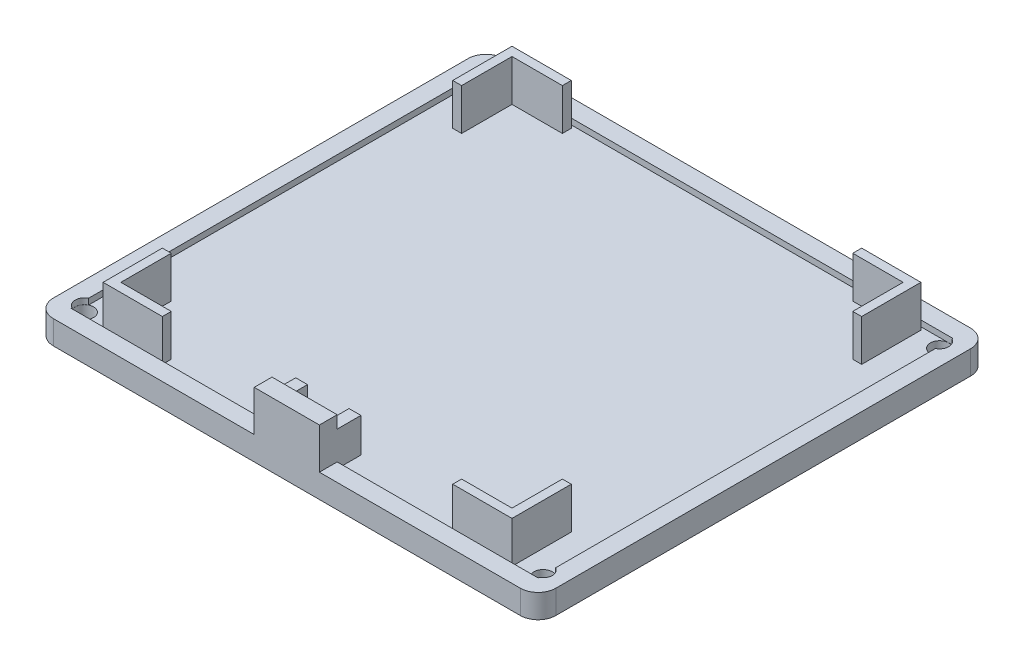
from build123d import *

# Parameters (mm, degrees)
SKETCH2_W           = 84.8
SKETCH2_H           = 76
SKETCH2_R           = 1.55
BOSS_EXTRUDE1_DEPTH = 3
SKETCH3_W           = 11
SKETCH3_H           = 3
BOSS_EXTRUDE2_DEPTH = 7.9
FILLET1_R           = 3
BOSS_EXTRUDE3_START = 1
BOSS_EXTRUDE3_DEPTH = 1
BOSS_EXTRUDE5_DEPTH = 7
SKETCH10_R          = 2.55
CUT_EXTRUDE2_DEPTH  = 1
CUT_EXTRUDE3_DEPTH  = 1
SKETCH13_W          = 2
SKETCH13_H          = 4
BOSS_EXTRUDE6_DEPTH = 5.8


with BuildPart() as part:
    # Sketch2 → Boss-Extrude1 (new body)
    with BuildSketch(Plane(origin=(0, 0, 0), x_dir=(1, 0, 0), z_dir=(0, 1, 0))):
        Rectangle(SKETCH2_W, SKETCH2_H)
        with Locations(Location((38.7, 33.44, 0), (0, 0, 270))):
            Circle(SKETCH2_R, mode=Mode.SUBTRACT)
        with Locations(Location((38.7, -33.44, 0), (0, 0, 270))):
            Circle(SKETCH2_R, mode=Mode.SUBTRACT)
        with Locations(Location((-38.7, 33.44, 0), (0, 0, 270))):
            Circle(SKETCH2_R, mode=Mode.SUBTRACT)
        with Locations(Location((-38.7, -33.44, 0), (0, 0, 270))):
            Circle(SKETCH2_R, mode=Mode.SUBTRACT)
    extrude(amount=BOSS_EXTRUDE1_DEPTH)

    # Sketch3 → Boss-Extrude2 (add)
    with BuildSketch(Plane(origin=(0, 3, 0), x_dir=(1, 0, 0), z_dir=(0, 1, 0))):
        with Locations((0, -36.5)):
            Rectangle(SKETCH3_W, SKETCH3_H)
    extrude(amount=BOSS_EXTRUDE2_DEPTH)

    # Fillet1
    fillet1_edges = [part.edges().sort_by_distance(p)[0] for p in [
        (42.4, 1.5, 38),
        (-42.4, 1.5, 38),
        (-42.4, 1.5, -38),
        (42.4, 1.5, -38),
    ]]
    fillet(fillet1_edges, radius=FILLET1_R)

    # Sketch4 → Boss-Extrude3 (add)
    with BuildSketch(Plane(origin=(0, 3, 0), x_dir=(1, 0, 0), z_dir=(0, 1, 0)).offset(BOSS_EXTRUDE3_START)):
        with BuildLine():
            Line((5.5, -38), (39.4, -38))
            ThreePointArc((39.4, -38), (41.521320344, -37.121320344), (42.4, -35))
            Line((42.4, -35), (42.4, 35))
            ThreePointArc((42.4, 35), (41.521320344, 37.121320344), (39.4, 38))
            Line((39.4, 38), (-39.4, 38))
            ThreePointArc((-39.4, 38), (-41.521320344, 37.121320344), (-42.4, 35))
            Line((-42.4, 35), (-42.4, -35))
            ThreePointArc((-42.4, -35), (-41.521320344, -37.121320344), (-39.4, -38))
            Line((-39.4, -38), (-5.5, -38))
            Line((-5.5, -38), (5.5, -38))
        make_face()
        with BuildLine():
            Line((39.4, -35), (39.4, -34.834130553))
            ThreePointArc((39.4, -34.834130553), (40.26, -33.44), (39.4, -32.045869447))
            Line((39.4, -32.045869447), (39.4, 32.045869447))
            ThreePointArc((39.4, 32.045869447), (40.26, 33.44), (39.4, 34.834130553))
            Line((39.4, 34.834130553), (39.4, 35))
            Line((39.4, 35), (-39.4, 35))
            Line((-39.4, 35), (-39.4, 34.834130553))
            ThreePointArc((-39.4, 34.834130553), (-40.26, 33.44), (-39.4, 32.045869447))
            Line((-39.4, 32.045869447), (-39.4, -32.045869447))
            ThreePointArc((-39.4, -32.045869447), (-40.26, -33.44), (-39.4, -34.834130553))
            Line((-39.4, -34.834130553), (-39.4, -35))
            Line((-39.4, -35), (-5.5, -35))
            Line((-5.5, -35), (5.5, -35))
            Line((5.5, -35), (39.4, -35))
        make_face(mode=Mode.SUBTRACT)
    extrude(amount=-BOSS_EXTRUDE3_DEPTH)

    # Sketch9 → Boss-Extrude5 (add)
    with BuildSketch(Plane(origin=(0, 3, 0), x_dir=(1, 0, 0), z_dir=(0, 1, 0))):
        Polygon((-34.5, 34.5), (-24.5, 34.5), (-24.5, 33), (-33, 33), (-33, 24.5), (-34.5, 24.5), align=None)
        Polygon((34.5, 34.5), (24.5, 34.5), (24.5, 33), (33, 33), (33, 24.5), (34.5, 24.5), align=None)
        Polygon((34.5, -34.5), (34.5, -24.5), (33, -24.5), (33, -33), (24.5, -33), (24.5, -34.5), align=None)
        Polygon((-34.5, -34.5), (-34.5, -24.5), (-33, -24.5), (-33, -33), (-24.5, -33), (-24.5, -34.5), align=None)
    extrude(amount=BOSS_EXTRUDE5_DEPTH)

    # Sketch10 → Cut-Extrude2 (cut)
    with BuildSketch(Plane.XZ):
        with Locations(Location((-38.7, 33.44, 0), (0, 0, 270))):
            Circle(SKETCH10_R)
        with Locations(Location((38.7, 33.44, 0), (0, 0, 270))):
            Circle(SKETCH10_R)
        with Locations(Location((38.7, -33.44, 0), (0, 0, 270))):
            Circle(SKETCH10_R)
        with Locations(Location((-38.7, -33.44, 0), (0, 0, 270))):
            Circle(SKETCH10_R)
    extrude(amount=-CUT_EXTRUDE2_DEPTH, mode=Mode.SUBTRACT)

    # Sketch11 → Cut-Extrude3 (cut)
    # profile 1 of 3: a face of its own
    with BuildSketch(Plane.XZ):
        with BuildLine():
            Line((2.339643561, -30.971841996), (1.428866317, -30.338368438))
            Line((1.428866317, -30.338368438), (4.960036189, -25.176449368))
            add(Edge.make_bspline(
                [(4.960036189, -25.176449368), (4.73473552, -25.20400134), (4.291105941, -25.258252711), (3.844294171, -25.268219143), (3.62439917, -25.273124047)],
                knots=[0, 0, 0, 0, 1.015715272, 2, 2, 2, 2], degree=3))
            add(Edge.make_bspline(
                [(3.62439917, -25.273124047), (3.491078025, -25.269709284), (3.229380276, -25.263006403), (2.844636851, -25.209877555), (2.474937817, -25.128052806), (2.121263297, -25.005955895), (1.782283951, -24.854215536), (1.458739791, -24.666048658), (1.15106636, -24.444682972), (0.862568043, -24.191288974), (0.600179734, -23.913057183), (0.366415196, -23.618578136), (0.172137374, -23.304431043), (0.010750907, -22.977024246), (-0.111642453, -22.631651916), (-0.200769375, -22.272244092), (-0.255641918, -21.896281849), (-0.262170064, -21.640376374), (-0.265484644, -21.510443759)],
                knots=[0, 0, 0, 0, 1.060718605, 2.082097864, 3.085795603, 4.069760067, 5.054557537, 6.03741023, 7.043284206, 8.066802108, 9.088538119, 10.083643548, 11.053783639, 12.022749082, 12.983451788, 13.964007469, 14.966251758, 16, 16, 16, 16], degree=3))
            add(Edge.make_bspline(
                [(-0.265484644, -21.510443759), (-0.259191124, -21.332757505), (-0.24683822, -20.983995433), (-0.147420743, -20.474421471), (0.016083916, -19.992596013), (0.244061169, -19.539785881), (0.531207158, -19.122504741), (0.876315471, -18.746553502), (1.277286999, -18.417279318), (1.724987468, -18.134235952), (2.208868429, -17.906597533), (2.715666132, -17.738814928), (3.241497367, -17.640122329), (3.59770577, -17.627110776), (3.7770434, -17.620559945)],
                knots=[0, 0, 0, 0, 1.022988612, 2.007919123, 2.978103895, 3.94594894, 4.918897164, 5.887013414, 6.875921846, 7.89917871, 8.930658928, 9.948724884, 10.967259574, 12, 12, 12, 12], degree=3))
            add(Edge.make_bspline(
                [(3.7770434, -17.620559945), (3.952987094, -17.627200822), (4.30063525, -17.64032257), (4.811861074, -17.736421543), (5.301504192, -17.898388899), (5.766850287, -18.122215744), (6.197704726, -18.402780181), (6.585148384, -18.737096881), (6.920339625, -19.12537408), (7.202729135, -19.558220887), (7.429406139, -20.023283933), (7.592954137, -20.508728452), (7.69363117, -21.01106324), (7.706317843, -21.351403189), (7.712720484, -21.523164111)],
                knots=[0, 0, 0, 0, 1.026385292, 2.028040595, 3.023318987, 4.028184125, 5.03290303, 6.015178782, 7.004435299, 8.016004309, 9.023023918, 10.015172535, 10.998308025, 12, 12, 12, 12], degree=3))
            add(Edge.make_bspline(
                [(7.712720484, -21.523164111), (7.708444543, -21.656491495), (7.699771866, -21.926912743), (7.63904298, -22.337777129), (7.535918308, -22.756700162), (7.418890716, -23.111289952), (7.305925422, -23.404146327), (7.199604172, -23.635473489), (7.081631501, -23.878955216), (6.944040552, -24.132038413), (6.796131647, -24.397949326), (6.629002272, -24.674020895), (6.446464911, -24.960623584), (6.316454214, -25.153834446), (6.249879939, -25.252771483)],
                knots=[0, 0, 0, 0, 1.179839688, 2.393009684, 3.667231171, 4.993948276, 5.694988576, 6.444077775, 7.246288328, 8.089075292, 8.993003841, 9.939041771, 10.944649915, 12, 12, 12, 12], degree=3))
            Line((6.249879939, -25.252771483), (2.339643561, -30.971841996))
        make_face()
        with BuildLine():
            add(Edge.make_bspline(
                [(3.835557022, -23.970559945), (3.936554731, -23.967800838), (4.133162934, -23.962429795), (4.421189133, -23.929739117), (4.693056957, -23.871776368), (4.949492633, -23.788610555), (5.193067391, -23.688256357), (5.419912354, -23.56048715), (5.63021737, -23.408026789), (5.825390705, -23.236721875), (5.99870579, -23.046401186), (6.153076215, -22.847203113), (6.284287417, -22.638253243), (6.387931308, -22.416934834), (6.473146768, -22.188635249), (6.531994983, -21.949678017), (6.564595278, -21.701308106), (6.570152707, -21.532584404), (6.572976894, -21.446841996)],
                knots=[0, 0, 0, 0, 1.163407946, 2.26475976, 3.333800367, 4.359385343, 5.366239384, 6.363380779, 7.350133999, 8.353570782, 9.349036268, 10.310270964, 11.253520213, 12.184142, 13.120487599, 14.056272588, 15.012232024, 16, 16, 16, 16], degree=3))
            add(Edge.make_bspline(
                [(6.572976894, -21.446841996), (6.570546952, -21.361063782), (6.565758452, -21.19202729), (6.527341679, -20.943289663), (6.459758726, -20.704916973), (6.369078968, -20.475604213), (6.249625533, -20.257235435), (6.106284313, -20.047069043), (5.935986567, -19.846437608), (5.740034398, -19.660059725), (5.528726163, -19.488254491), (5.303535205, -19.336630729), (5.066317653, -19.209553817), (4.818520732, -19.10469184), (4.559628152, -19.022861112), (4.289793109, -18.964015245), (4.007652066, -18.931460593), (3.816131399, -18.92593829), (3.718529779, -18.923124047)],
                knots=[0, 0, 0, 0, 0.972161553, 1.915763587, 2.844109794, 3.775983486, 4.705125789, 5.659731448, 6.655561913, 7.682237399, 8.721216875, 9.739758359, 10.754845918, 11.767244016, 12.7857855, 13.828538656, 14.893392813, 16, 16, 16, 16], degree=3))
            add(Edge.make_bspline(
                [(3.718529779, -18.923124047), (3.621776994, -18.925942836), (3.431948826, -18.931473278), (3.152316019, -18.963953365), (2.884305496, -19.023256865), (2.626163045, -19.104653936), (2.378373488, -19.209561639), (2.141167124, -19.336637388), (1.915923491, -19.488219589), (1.704817847, -19.660194906), (1.508519673, -19.845570079), (1.341149896, -20.04794795), (1.197480631, -20.25712611), (1.078191335, -20.475633268), (0.987467915, -20.704909219), (0.919896652, -20.943291763), (0.881476738, -21.192026743), (0.876688669, -21.361063598), (0.874258945, -21.446841996)],
                knots=[0, 0, 0, 0, 1.099389452, 2.15699305, 3.192601482, 4.213358962, 5.227959689, 6.245255729, 7.266013209, 8.307253147, 9.336162325, 10.327954924, 11.284637477, 12.215801273, 13.149702402, 14.080068371, 15.025723358, 16, 16, 16, 16], degree=3))
            add(Edge.make_bspline(
                [(0.874258945, -21.446841996), (0.876457592, -21.532651174), (0.880793724, -21.701882579), (0.922623133, -21.950535491), (0.992575748, -22.188889794), (1.086263251, -22.419263103), (1.20964045, -22.639415274), (1.361038412, -22.848302558), (1.538495679, -23.048292906), (1.739640049, -23.236279075), (1.959778804, -23.40882554), (2.194898426, -23.559521498), (2.440951262, -23.686784368), (2.698803466, -23.788897389), (2.966544139, -23.870945425), (3.246579616, -23.92963229), (3.537983792, -23.962116229), (3.735414298, -23.96771837), (3.835557022, -23.970559945)],
                knots=[0, 0, 0, 0, 0.952633368, 1.87876736, 2.791047057, 3.707742249, 4.635551637, 5.587206343, 6.568248508, 7.601284464, 8.641511608, 9.671105535, 10.699146789, 11.713763218, 12.747829548, 13.806491675, 14.887386225, 16, 16, 16, 16], degree=3))
        make_face(mode=Mode.SUBTRACT)
    # profile 2 of 3: a face of its own
    with BuildSketch(Plane.XZ):
        with BuildLine():
            add(Edge.make_bspline(
                [(9.340925612, -24.301289111), (9.342115849, -24.097735733), (9.344427902, -23.702330362), (9.370148744, -23.126168946), (9.412876415, -22.585655897), (9.471432025, -22.080765344), (9.542689839, -21.611366941), (9.637814605, -21.178715108), (9.745992488, -20.780807392), (9.871368506, -20.416346245), (10.012838483, -20.080421437), (10.166814229, -19.766821421), (10.339406483, -19.476020695), (10.520751282, -19.203377855), (10.71818937, -18.953355877), (10.926102124, -18.72242393), (11.152604361, -18.515919207), (11.389996419, -18.327791196), (11.64042759, -18.162874541), (11.89675955, -18.01761289), (12.160756649, -17.893516229), (12.433139655, -17.795942361), (12.711460365, -17.715348717), (12.996691722, -17.660234536), (13.289304671, -17.625556611), (13.48681302, -17.622241302), (13.586979298, -17.620559945)],
                knots=[0, 0, 0, 0, 1.646270934, 3.197905019, 4.663502075, 6.030701355, 7.308322542, 8.50163776, 9.611534131, 10.641858119, 11.616356847, 12.558055219, 13.465016945, 14.349605745, 15.204443733, 16.039544428, 16.859896111, 17.680448484, 18.487036065, 19.28249412, 20.06191084, 20.843045899, 21.620316918, 22.403196591, 23.190181807, 24, 24, 24, 24], degree=3))
            add(Edge.make_bspline(
                [(13.586979298, -17.620559945), (13.68798232, -17.622330017), (13.888845552, -17.625850134), (14.185809199, -17.659682725), (14.47591233, -17.7158208), (14.757918148, -17.795362622), (15.034143099, -17.894044078), (15.302426635, -18.017731617), (15.564435188, -18.161709221), (15.816005089, -18.33088729), (16.059898122, -18.519508693), (16.290123587, -18.732733234), (16.506702442, -18.968407929), (16.712352836, -19.224011264), (16.901240288, -19.504445715), (17.081121028, -19.80483377), (17.24212813, -20.130428622), (17.397193951, -20.475797749), (17.531041017, -20.850497311), (17.651749965, -21.252415156), (17.749282222, -21.686298634), (17.830523296, -22.149871295), (17.89346049, -22.644835592), (17.939298934, -23.170130508), (17.9635127, -23.72610164), (17.96807273, -24.106222978), (17.970412791, -24.301289111)],
                knots=[0, 0, 0, 0, 0.810914788, 1.612654377, 2.396697861, 3.181598691, 3.963628158, 4.749916497, 5.551656086, 6.361998678, 7.18212741, 8.025565596, 8.878627764, 9.750805457, 10.657531673, 11.591944965, 12.560506719, 13.57287815, 14.630710178, 15.753379473, 16.941251878, 18.199788006, 19.531962791, 20.947069417, 22.433333509, 24, 24, 24, 24], degree=3))
            add(Edge.make_bspline(
                [(17.970412791, -24.301289111), (17.96804847, -24.495504434), (17.963441687, -24.873925071), (17.93957038, -25.42739461), (17.892549061, -25.949901796), (17.833729961, -26.44269976), (17.752265038, -26.903737405), (17.65209772, -27.334610118), (17.540880835, -27.737178607), (17.403594582, -28.108144923), (17.253332861, -28.452684032), (17.089846864, -28.774419113), (16.914696352, -29.076193946), (16.723874334, -29.355593028), (16.520480521, -29.614595584), (16.300161687, -29.848629815), (16.069128421, -30.063334824), (15.824517655, -30.254385015), (15.569024312, -30.421607021), (15.307915662, -30.571154421), (15.036558813, -30.691741628), (14.761103242, -30.795283063), (14.477608885, -30.87438756), (14.186429125, -30.929084121), (13.889045068, -30.967444828), (13.688016532, -30.970371198), (13.586979298, -30.971841996)],
                knots=[0, 0, 0, 0, 1.561518951, 3.042555995, 4.452378317, 5.7783523, 7.031515105, 8.214008947, 9.334062868, 10.386615937, 11.391082383, 12.354592575, 13.286541444, 14.194233754, 15.072674879, 15.931287219, 16.775624067, 17.606195743, 18.42308326, 19.229000347, 20.022332153, 20.807536673, 21.593273796, 22.3848459, 23.188221202, 24, 24, 24, 24], degree=3))
            add(Edge.make_bspline(
                [(13.586979298, -30.971841996), (13.486815799, -30.970149792), (13.289312929, -30.966813096), (12.996659842, -30.932291841), (12.712606404, -30.876791015), (12.435750926, -30.799079338), (12.164672999, -30.703956932), (11.903066474, -30.580027851), (11.648022593, -30.437301372), (11.400221804, -30.274757986), (11.164320534, -30.088533593), (10.938991309, -29.882560317), (10.729894811, -29.651698224), (10.535279664, -29.399592618), (10.350316544, -29.128562853), (10.180175104, -28.834908471), (10.022800862, -28.519793855), (9.878951624, -28.181183151), (9.751412188, -27.81413527), (9.638753361, -27.414451108), (9.54980199, -26.978602942), (9.473663838, -26.510091353), (9.412252505, -26.006903092), (9.37032681, -25.468764982), (9.344414038, -24.896012367), (9.34210964, -24.503147757), (9.340925612, -24.301289111)],
                knots=[0, 0, 0, 0, 0.810891512, 1.598919785, 2.382837074, 3.152667961, 3.926044502, 4.706494248, 5.493654104, 6.291793342, 7.103789334, 7.925228297, 8.761435821, 9.622817696, 10.50288917, 11.416980706, 12.369136599, 13.353924996, 14.394355917, 15.514179734, 16.714354668, 17.994756427, 19.357759367, 20.818452758, 22.365282078, 24, 24, 24, 24], degree=3))
        make_face()
        with BuildLine():
            add(Edge.make_bspline(
                [(10.480669202, -24.29620097), (10.481102624, -24.465831963), (10.481943811, -24.795052411), (10.503919168, -25.273455101), (10.533855724, -25.719661723), (10.572468431, -26.134238841), (10.629810558, -26.515783172), (10.694060903, -26.866918879), (10.772249685, -27.185787711), (10.864760178, -27.474577767), (10.970130616, -27.738190101), (11.085177607, -27.983485939), (11.208769373, -28.213362965), (11.347087433, -28.425756344), (11.497727806, -28.621358711), (11.657287917, -28.803632131), (11.831722723, -28.966181178), (12.073036303, -29.161132909), (12.391612082, -29.362588051), (12.793006305, -29.538015292), (13.205460399, -29.648260205), (13.48540922, -29.662280119), (13.625140356, -29.669277893)],
                knots=[0, 0, 0, 0, 1.459021318, 2.831673884, 4.118529203, 5.306027144, 6.411944654, 7.436330062, 8.375795394, 9.233974572, 10.042671642, 10.816086306, 11.563610507, 12.285937304, 12.993564865, 13.685989202, 14.367179055, 15.041617293, 16.353048772, 17.594441528, 18.799311195, 20, 20, 20, 20], degree=3))
            add(Edge.make_bspline(
                [(13.625140356, -29.669277893), (13.765775336, -29.663480232), (14.046754937, -29.651896878), (14.457268994, -29.54014146), (14.855795974, -29.371523416), (15.168114157, -29.172142468), (15.405722243, -28.982265387), (15.575963893, -28.820377949), (15.732217612, -28.639109516), (15.880415998, -28.443532071), (16.016338929, -28.229909057), (16.139939458, -27.999267712), (16.252727604, -27.750967552), (16.316986142, -27.577631642), (16.349839875, -27.489009464)],
                knots=[0, 0, 0, 0, 1.353760809, 2.704726607, 4.075137775, 5.516104923, 6.260822281, 7.007110065, 7.778089737, 8.566572457, 9.372053459, 10.217411131, 11.088608312, 12, 12, 12, 12], degree=3))
            add(Edge.make_bspline(
                [(16.349839875, -27.489009464), (16.388127718, -27.375690124), (16.46586846, -27.145603265), (16.566059755, -26.788683727), (16.644964489, -26.414205127), (16.715951559, -26.024405417), (16.764404076, -25.616409931), (16.803403284, -25.191481052), (16.826374634, -24.749298395), (16.829222159, -24.448870855), (16.830669202, -24.29620097)],
                knots=[0, 0, 0, 0, 0.884706709, 1.796334032, 2.740027952, 3.714592787, 4.726048262, 5.777819803, 6.87074269, 8, 8, 8, 8], degree=3))
            add(Edge.make_bspline(
                [(16.830669202, -24.29620097), (16.828672801, -24.143555779), (16.824767414, -23.844949152), (16.809839516, -23.407640325), (16.771291117, -22.992285878), (16.728477171, -22.597096449), (16.665350112, -22.224259636), (16.59728607, -21.870654243), (16.505841671, -21.540660981), (16.408161344, -21.229113356), (16.296363623, -20.939550982), (16.173297959, -20.670623814), (16.04186472, -20.421033527), (15.899108591, -20.19146491), (15.746724255, -19.980889683), (15.580689719, -19.793529869), (15.407590995, -19.623578584), (15.165140064, -19.429585834), (14.847733355, -19.231786253), (14.452779149, -19.04975621), (14.041768525, -18.945223262), (13.763916278, -18.930485141), (13.625140356, -18.923124047)],
                knots=[0, 0, 0, 0, 1.31362396, 2.569729283, 3.763502607, 4.902122613, 5.988968491, 7.01645872, 7.998833611, 8.933434873, 9.825090667, 10.667526885, 11.477055099, 12.250526234, 12.991942729, 13.710640831, 14.402115721, 15.076753259, 16.378508321, 17.609869233, 18.806226677, 20, 20, 20, 20], degree=3))
            add(Edge.make_bspline(
                [(13.625140356, -18.923124047), (13.484676207, -18.930495296), (13.203492018, -18.945251224), (12.78820944, -19.049366744), (12.390139364, -19.230842363), (12.073571998, -19.430240972), (11.830951973, -19.620154273), (11.660109057, -19.784842264), (11.499921518, -19.964987244), (11.352355863, -20.162388478), (11.214146178, -20.374534239), (11.087215076, -20.603093471), (10.972852194, -20.849224421), (10.867316877, -21.112718344), (10.774524189, -21.401483485), (10.697983236, -21.719959548), (10.627273072, -22.069978412), (10.577215954, -22.453589198), (10.53271604, -22.868270155), (10.504118006, -23.31559071), (10.4818703, -23.794795747), (10.481077587, -24.125718408), (10.480669202, -24.29620097)],
                knots=[0, 0, 0, 0, 1.207732386, 2.417664972, 3.655092373, 4.956220595, 5.625982001, 6.301752483, 6.994047911, 7.697131622, 8.419323945, 9.170223765, 9.943494443, 10.752040957, 11.610060368, 12.549350801, 13.567764191, 14.679664412, 15.874934091, 17.154273443, 18.533957287, 20, 20, 20, 20], degree=3))
        make_face(mode=Mode.SUBTRACT)
    # profile 3 of 3: a face of its own
    with BuildSketch(Plane.XZ):
        Polygon((19.435797407, -17.94620097), (20.611157984, -17.94620097), (23.099258945, -27.267675329), (26.79324933, -17.94620097), (26.958613913, -17.94620097), (30.589002535, -27.196441355), (33.087279779, -17.94620097), (34.252464074, -17.94620097), (30.828145163, -30.64620097), (30.66532465, -30.64620097), (26.84413074, -20.938027893), (22.982231702, -30.64620097), (22.816867118, -30.64620097), align=None)
    extrude(amount=-CUT_EXTRUDE3_DEPTH, mode=Mode.SUBTRACT)

    # Sketch13 → Boss-Extrude6 (add)
    with BuildSketch(Plane(origin=(0, 3, 0), x_dir=(1, 0, 0), z_dir=(0, 1, 0))):
        with Locations((-4.5, -33)):
            Rectangle(SKETCH13_W, SKETCH13_H)
        with Locations((4.5, -33)):
            Rectangle(SKETCH13_W, SKETCH13_H)
    extrude(amount=BOSS_EXTRUDE6_DEPTH)


solid = part.part
